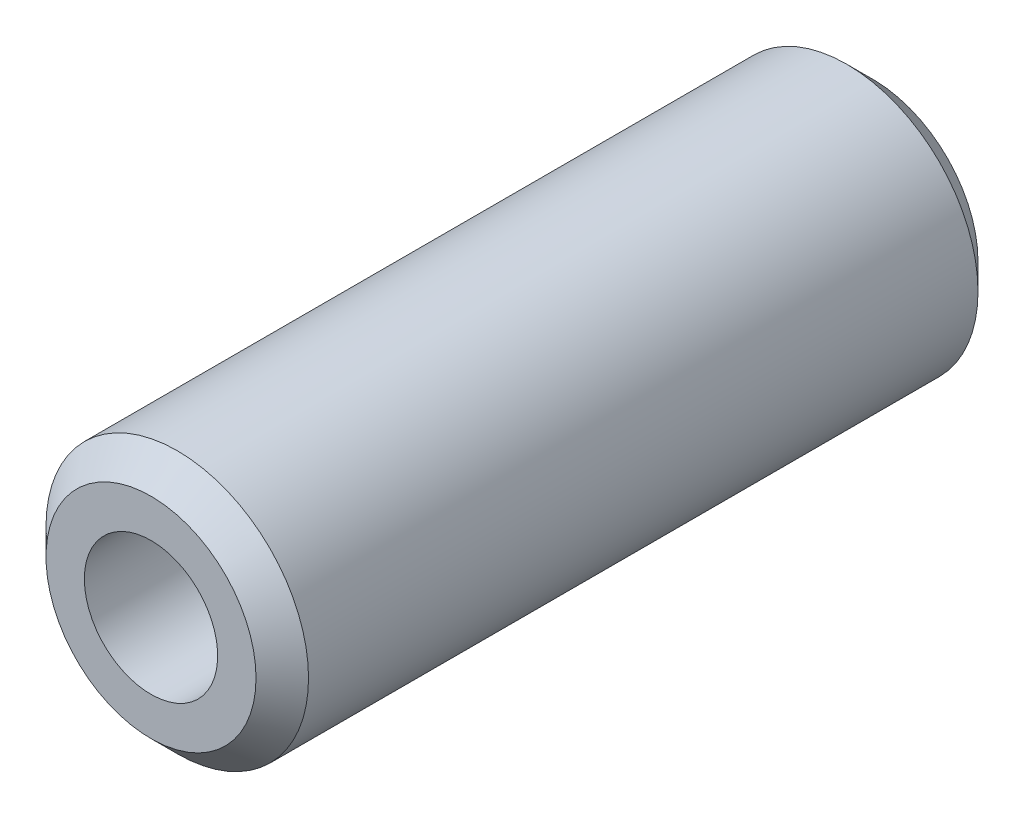
from build123d import *

# Parameters (mm, degrees)
SKETCH1_R           = 12.7
BOSS_EXTRUDE1_DEPTH = 69.85
SKETCH2_R           = 6.45
CUT_EXTRUDE1_DEPTH  = 73.122135992
CHAMFER1_SIZE       = 2.54


with BuildPart() as part:
    # Sketch1 → Boss-Extrude1 (new body)
    with BuildSketch(Plane.XY):
        Circle(SKETCH1_R)
    extrude(amount=BOSS_EXTRUDE1_DEPTH)

    # Sketch2 → Cut-Extrude1 (cut, through all)
    with BuildSketch(Plane(origin=(0, 0, 0), x_dir=(-1, 0, 0), z_dir=(0, 0, -1))):
        Circle(SKETCH2_R)
    extrude(amount=-CUT_EXTRUDE1_DEPTH, mode=Mode.SUBTRACT)

    # Chamfer1
    chamfer1_edges = [part.edges().sort_by_distance(p)[0] for p in [
        (-12.7, 0, 0),
        (-12.7, 0, 69.85),
    ]]
    chamfer(chamfer1_edges, length=CHAMFER1_SIZE)


solid = part.part
